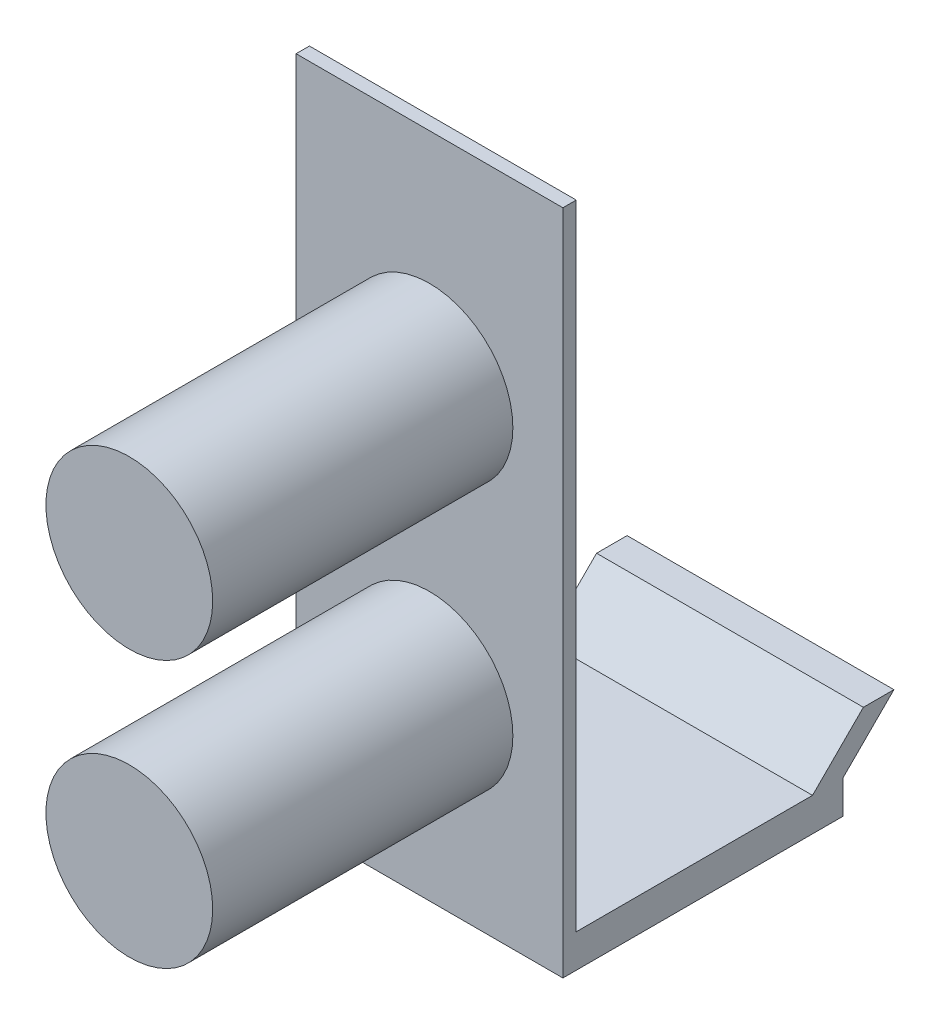
from build123d import *

# Parameters (mm, degrees)
SKETCH1_W           = 50.8
SKETCH1_H           = 127
BOSS_EXTRUDE1_DEPTH = 2.54
SKETCH2_R           = 15.875
BOSS_EXTRUDE2_DEPTH = 57.15
SKETCH3_W           = 50.8
SKETCH3_H           = 6.35
BOSS_EXTRUDE3_DEPTH = 50.8
BOSS_EXTRUDE4_DEPTH = 50.8


with BuildPart() as part:
    # Sketch1 → Boss-Extrude1 (new body)
    with BuildSketch(Plane.XY):
        Rectangle(SKETCH1_W, SKETCH1_H)
    extrude(amount=BOSS_EXTRUDE1_DEPTH)

    # Sketch2 → Boss-Extrude2 (add)
    with BuildSketch(Plane.XY.offset(2.54)):
        with Locations((0, 22.465516187)):
            Circle(SKETCH2_R)
        with Locations((0, -28.334483813)):
            Circle(SKETCH2_R)
    extrude(amount=BOSS_EXTRUDE2_DEPTH)

    # Sketch3 → Boss-Extrude3 (add)
    with BuildSketch(Plane(origin=(0, 0, 0), x_dir=(-1, 0, 0), z_dir=(0, 0, -1))):
        with Locations((0, -60.325)):
            Rectangle(SKETCH3_W, SKETCH3_H)
    extrude(amount=BOSS_EXTRUDE3_DEPTH)

    # Sketch4 → Boss-Extrude4 (add)
    with BuildSketch(Plane(origin=(25.4, 0, 0), x_dir=(0, 0, -1), z_dir=(1, 0, 0))):
        Polygon((44.45, -63.5), (60.482117808, -47.467882192), (54.66777369, -47.467882192), (38.635655882, -63.5), align=None)
    extrude(amount=-BOSS_EXTRUDE4_DEPTH)


solid = part.part
